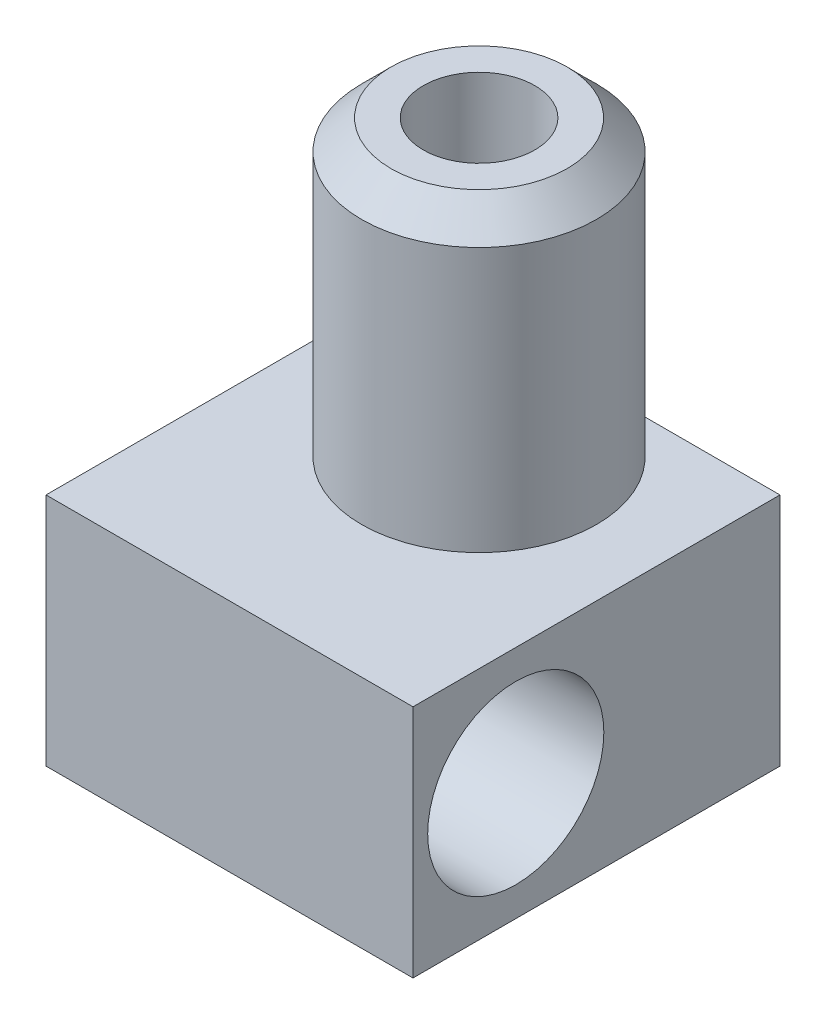
from build123d import *

# Parameters (mm, degrees)
SCHIZZO2_W                   = 12.5
SCHIZZO2_H                   = 12.5
SCHIZZO2_R                   = 0.15
ESTRUSIONE_ESTRUSIONE1_DEPTH = 8
SCHIZZO3_R                   = 3
TAGLIO_ESTRUSIONE1_DEPTH     = 18.102631376
SCHIZZO4_R                   = 0.75
TAGLIO_ESTRUSIONE2_DEPTH     = 3.5
ESTRUSIONE_ESTRUSIONE2_START = 10
SCHIZZO5_R                   = 4
ESTRUSIONE_ESTRUSIONE2_DEPTH = 10
SMUSSO1_SIZE                 = 1
FORO_3_8_3_8_1_D             = 3.8
FORO_3_8_3_8_1_DEPTH         = 15
FORO_3_8_3_8_1_TIP           = 1.141635176


with BuildPart() as part:
    # Schizzo1 → Rivoluzione1 (revolve)
    with BuildSketch(Plane.XY, mode=Mode.PRIVATE) as rivoluzione1_sk:
        Polygon((-0.15, 0), (-0.15, -3), (-0.5, -3), (-4, -1), (-4, 0), align=None)
    revolve(rivoluzione1_sk.sketch.rotate(Axis((0, -26.528171736, 0), (0, 1, 0)), 270), axis=Axis((0, -26.528171736, 0), (0, 1, 0)))

    # Schizzo2 → Estrusione-Estrusione1 (add)
    with BuildSketch(Plane(origin=(0, 0, 0), x_dir=(1, 0, 0), z_dir=(0, 1, 0))):
        with Locations((0, -2.25)):
            Rectangle(SCHIZZO2_W, SCHIZZO2_H)
        with Locations(Location((0, 0, 0), (0, 0, 90))):
            Circle(SCHIZZO2_R, mode=Mode.SUBTRACT)
    extrude(amount=ESTRUSIONE_ESTRUSIONE1_DEPTH)

    # Schizzo3 → Taglio-Estrusione1 (cut, through all)
    with BuildSketch(Plane(origin=(6.25, 0, 0), x_dir=(0, 0, -1), z_dir=(1, 0, 0))):
        with Locations((-5, 4)):
            Circle(SCHIZZO3_R)
    extrude(amount=-TAGLIO_ESTRUSIONE1_DEPTH, mode=Mode.SUBTRACT)

    # Schizzo4 → Taglio-Estrusione2 (cut)
    with BuildSketch(Plane(origin=(0, 0, -4), x_dir=(-1, 0, 0), z_dir=(0, 0, -1))):
        with Locations((-5.3, 4)):
            Circle(SCHIZZO4_R)
    extrude(amount=-TAGLIO_ESTRUSIONE2_DEPTH, mode=Mode.SUBTRACT)

    # Schizzo5 → Estrusione-Estrusione2 (add)
    with BuildSketch(Plane(origin=(0, 8, 0), x_dir=(1, 0, 0), z_dir=(0, 1, 0)).offset(ESTRUSIONE_ESTRUSIONE2_START)):
        with Locations(Location((0, 0, 0), (0, 0, 90))):
            Circle(SCHIZZO5_R)
    extrude(amount=-ESTRUSIONE_ESTRUSIONE2_DEPTH)

    # Smusso1
    smusso1_edges = [part.edges().sort_by_distance(p)[0] for p in [
        (0, 18, 4),
    ]]
    chamfer(smusso1_edges, length=SMUSSO1_SIZE)

    # Foro Ø3.8 (3.8)-1
    with Locations(Plane(origin=(0, 18, 0), x_dir=(1, 0, 0), z_dir=(0, 1, 0))):
        with Locations((0, 0)):
            Hole(FORO_3_8_3_8_1_D / 2, depth=FORO_3_8_3_8_1_DEPTH)
            with Locations((0, 0, -(FORO_3_8_3_8_1_DEPTH + FORO_3_8_3_8_1_TIP / 2))):  # 118° drill point
                Cone(0, FORO_3_8_3_8_1_D / 2, FORO_3_8_3_8_1_TIP, mode=Mode.SUBTRACT)


solid = part.part
